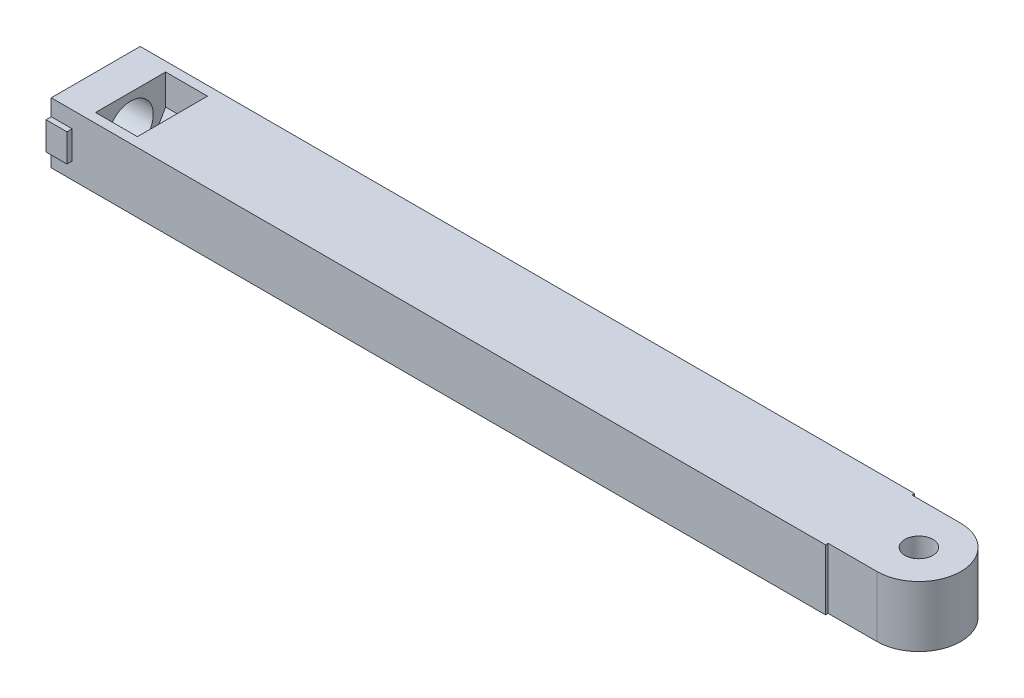
from build123d import *

# Parameters (mm, degrees)
BOSS_EXTRUDE1_DEPTH      = 4.35
BOSS_EXTRUDE1_DEPTH_BACK = 4.35
SKETCH3_R                = 2
BOSS_EXTRUDE2_DEPTH      = 111
SKETCH5_R                = 3.25
CUT_EXTRUDE1_DEPTH       = 113
CUT_EXTRUDE2_START       = -5
CUT_EXTRUDE2_DEPTH       = 6
SKETCH8_W                = 0.75
SKETCH8_H                = 4
BOSS_EXTRUDE4_DEPTH      = 3


with BuildPart() as part:
    # Sketch3 → Boss-Extrude1 (new, two sides: drawn at the far end of the back side and taken through both)
    with BuildSketch(Plane(origin=(0, 0, 0), x_dir=(1, 0, 0), z_dir=(0, 1, 0)).offset(-BOSS_EXTRUDE1_DEPTH_BACK)):
        with BuildLine():
            Line((0, 6), (-7, 6))
            Line((-7, 6), (-7, -6))
            Line((-7, -6), (0, -6))
            ThreePointArc((0, -6), (6, 0), (0, 6))
        make_face()
        Circle(SKETCH3_R, mode=Mode.SUBTRACT)
    extrude(amount=BOSS_EXTRUDE1_DEPTH + BOSS_EXTRUDE1_DEPTH_BACK)

    # Sketch4 → Boss-Extrude2 (add)
    with BuildSketch(Plane.ZY.offset(7)):
        Polygon((-6.375, -4.35), (6.375, -4.35), (6.375, 0.817855369), (6.375, 4.35), (-6.375, 4.35), (-6.375, -0.75), align=None)
    extrude(amount=BOSS_EXTRUDE2_DEPTH)

    # Sketch5 → Cut-Extrude1 (cut)
    with BuildSketch(Plane.ZY.offset(118)):
        Circle(SKETCH5_R)
    extrude(amount=-CUT_EXTRUDE1_DEPTH, mode=Mode.SUBTRACT)

    # Sketch6 → Cut-Extrude2 (cut)
    with BuildSketch(Plane.ZY.offset(118).offset(CUT_EXTRUDE2_START)):
        Polygon((-5.025, 0), (-5.025, 4.351777654), (-2.5125, 4.351777654), (2.5125, 4.351777654), (5.025, 4.351777654), (5.025, 0), (2.5125, -4.351777654), (-2.5125, -4.351777654), align=None)
    extrude(amount=-CUT_EXTRUDE2_DEPTH, mode=Mode.SUBTRACT)

    # Sketch8 → Boss-Extrude4 (add)
    with BuildSketch(Plane.ZY.offset(118)):
        with Locations((-6.75, 0)):
            Rectangle(SKETCH8_W, SKETCH8_H)
        with Locations((6.75, 0)):
            Rectangle(SKETCH8_W, SKETCH8_H)
    extrude(amount=-BOSS_EXTRUDE4_DEPTH)


solid = part.part
